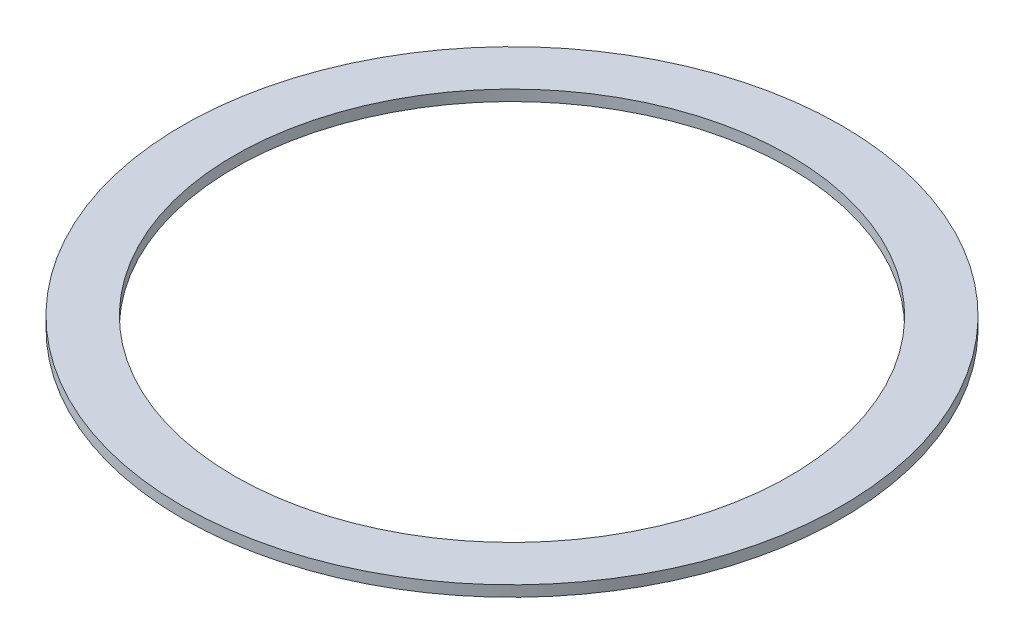
from build123d import *

# Parameters (mm, degrees)
SKETCH1_R           = 76.2
SKETCH1_R_2         = 64.2
BOSS_EXTRUDE1_DEPTH = 2.5


with BuildPart() as part:
    # Sketch1 → Boss-Extrude1 (new body)
    with BuildSketch(Plane(origin=(0, 0, 0), x_dir=(1, 0, 0), z_dir=(0, 1, 0))):
        with Locations(Location((0, 0, 0), (0, 0, 270))):
            Circle(SKETCH1_R)
        with Locations(Location((0, 0, 0), (0, 0, 270))):
            Circle(SKETCH1_R_2, mode=Mode.SUBTRACT)
    extrude(amount=BOSS_EXTRUDE1_DEPTH)


solid = part.part
